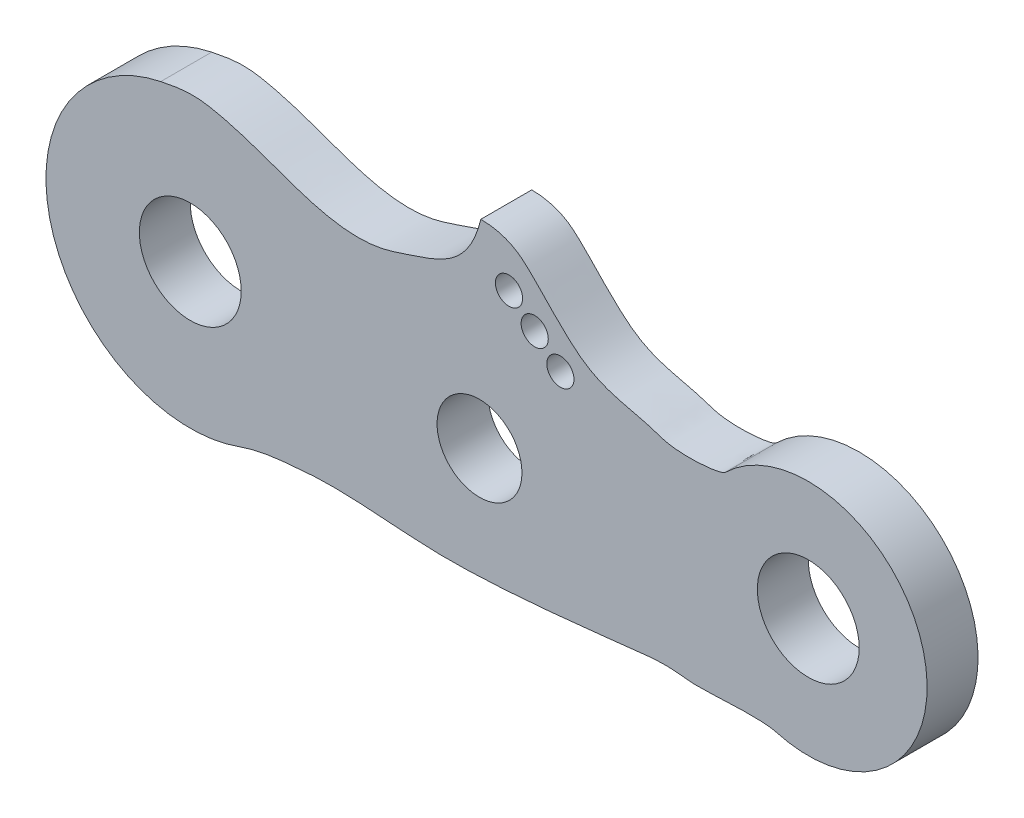
from build123d import *

# Parameters (mm, degrees)
SKETCH1_R           = 15
SKETCH1_R_2         = 12.5
SKETCH1_R_3         = 4
BOSS_EXTRUDE1_DEPTH = 15


with BuildPart() as part:
    # Sketch1 → Boss-Extrude1 (new body)
    with BuildSketch(Plane.XY):
        with BuildLine():
            ThreePointArc((-8.692383901, 41.601592062), (-40.885857936, -11.601578378), (14.453121839, -39.966952212))
            add(Edge.make_bspline(
                [(14.453121839, -39.966952212), (20.324183093, -37.843819), (27.727764191, -37.215036977), (43.472623732, -35.833837226), (58.397602455, -37.276370761), (84.946315016, -38.583245304), (114.704531254, -35.522221035), (142.355688015, -32.171380422), (144.567405538, -33.689959174), (153.929721624, -33.475356197), (168.590787669, -32.59797777), (172.613360968, -33.717814397)],
                knots=[0, 0, 0, 0, 0.11255921, 0.148246658, 0.333693611, 0.392620141, 0.678585426, 0.734324885, 0.894275272, 0.922842164, 1, 1, 1, 1], degree=3))
            ThreePointArc((172.613360968, -33.717814397), (215.91075058, 8.663774875), (157.59040834, 25.083297929))
            add(Edge.make_bspline(
                [(85.576729013, 53.615490069), (89.951099637, 53.597826548), (95.065965871, 51.958379885), (103.617048542, 44.431536157), (117.031089923, 27.951919231), (131.204676748, 27.358750312), (143.43335667, 22.709079443), (156.177574778, 23.708411323), (157.59040834, 25.083297929)],
                knots=[0, 0, 0, 0, 0.13386012, 0.179539567, 0.456794471, 0.762138658, 0.816459211, 1, 1, 1, 1], degree=3))
            add(Edge.make_bspline(
                [(-8.692383901, 41.601592062), (-2.649418853, 42.86423057), (1.654490906, 43.280309596), (17.705998641, 39.789174665), (32.677991729, 32.904373306), (51.236480337, 29.501510111), (71.851804055, 36.549367458), (82.042198718, 39.131213847), (85.576729013, 53.615490069)],
                knots=[0, 0, 0, 0, 0.135925504, 0.178703955, 0.427784514, 0.654064452, 0.711286, 1, 1, 1, 1], degree=3))
        make_face()
        Circle(SKETCH1_R, mode=Mode.SUBTRACT)
        with Locations((182, 0)):
            Circle(SKETCH1_R, mode=Mode.SUBTRACT)
        with Locations((85.180976595, -5)):
            Circle(SKETCH1_R_2, mode=Mode.SUBTRACT)
        with Locations((93.863357503, 39.547847307)):
            Circle(SKETCH1_R_3, mode=Mode.SUBTRACT)
        with Locations((101.433042145, 33.013333215)):
            Circle(SKETCH1_R_3, mode=Mode.SUBTRACT)
        with Locations((109.002726787, 26.478819122)):
            Circle(SKETCH1_R_3, mode=Mode.SUBTRACT)
    extrude(amount=BOSS_EXTRUDE1_DEPTH)


solid = part.part
